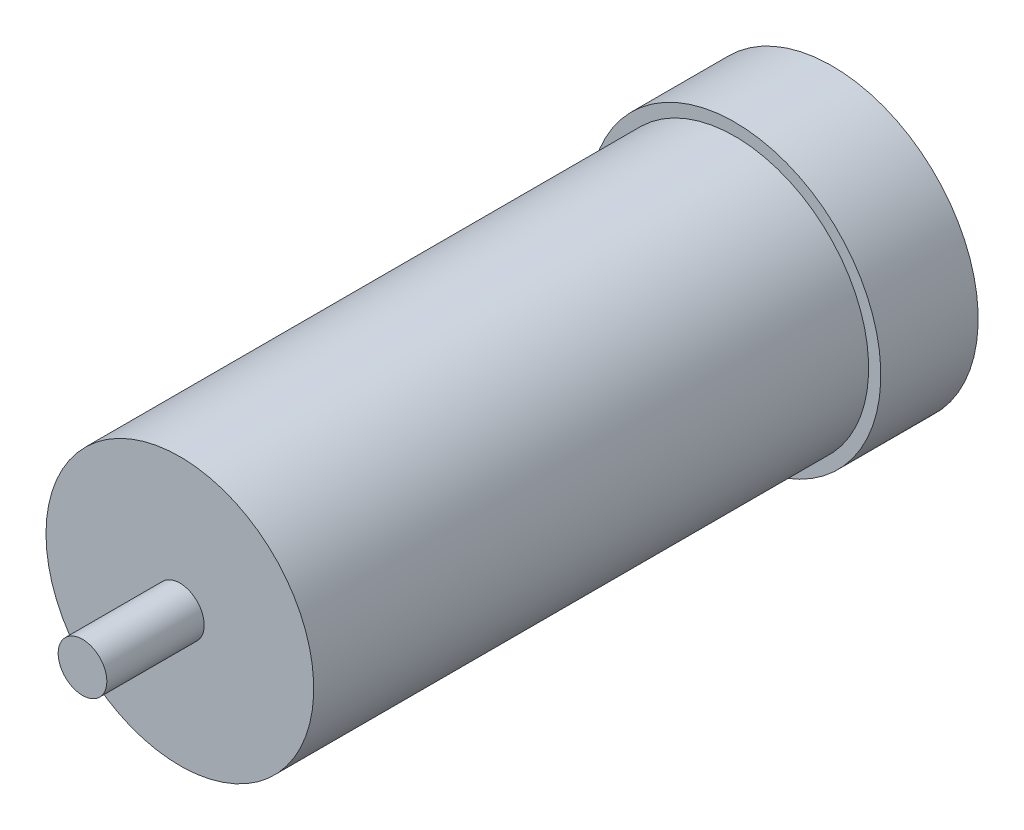
from build123d import *

# Parameters (mm, degrees)
SKETCH1_R           = 6.875
BOSS_EXTRUDE1_DEPTH = 28.5
SKETCH2_R           = 7.5
BOSS_EXTRUDE2_DEPTH = 5
SKETCH3_R           = 1.25
BOSS_EXTRUDE3_DEPTH = 5


with BuildPart() as part:
    # Sketch1 → Boss-Extrude1 (new body)
    with BuildSketch(Plane.XY):
        with Locations(Location((0, 0, 0), (0, 0, 180))):
            Circle(SKETCH1_R)
    extrude(amount=BOSS_EXTRUDE1_DEPTH)

    # Sketch2 → Boss-Extrude2 (add)
    with BuildSketch(Plane(origin=(0, 0, 0), x_dir=(-1, 0, 0), z_dir=(0, 0, -1))):
        Circle(SKETCH2_R)
    extrude(amount=BOSS_EXTRUDE2_DEPTH)

    # Sketch3 → Boss-Extrude3 (add)
    with BuildSketch(Plane.XY.offset(28.5)):
        Circle(SKETCH3_R)
    extrude(amount=BOSS_EXTRUDE3_DEPTH)


solid = part.part
